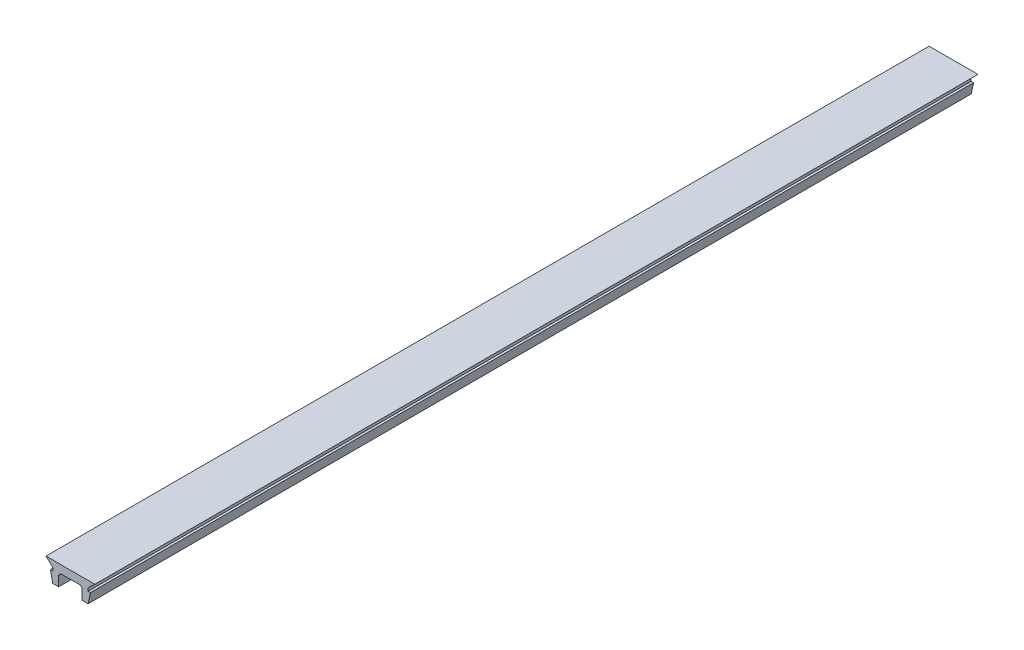
from build123d import *

# Parameters (mm, degrees)
BOSS_EXTRUDE1_DEPTH = 150


with BuildPart() as part:
    # Sketch1 → Boss-Extrude1 (new body)
    with BuildSketch(Plane.XY):
        with BuildLine():
            Line((6, 0), (6.4, 1.85))
            Line((6.4, 1.85), (6, 1.85))
            Line((6, 1.85), (6, 2.35))
            Line((6, 2.35), (7.15, 3.45))
            Line((7.15, 3.45), (6, 3.45))
            Line((6, 3.45), (0, 3.45))
            Line((0, 3.45), (-1.15, 3.45))
            Line((-1.15, 3.45), (0, 2.35))
            Line((0, 2.35), (0, 1.85))
            Line((0, 1.85), (-0.4, 1.85))
            Line((-0.4, 1.85), (0, 0))
            Line((0, 0), (1, 0))
            Line((1, 0), (1, 1.6))
            ThreePointArc((1, 1.6), (1.146446609, 1.953553391), (1.5, 2.1))
            Line((1.5, 2.1), (4.5, 2.1))
            ThreePointArc((4.5, 2.1), (4.853553391, 1.953553391), (5, 1.6))
            Line((5, 1.6), (5, 0))
            Line((5, 0), (6, 0))
        make_face()
    extrude(amount=BOSS_EXTRUDE1_DEPTH)


solid = part.part
